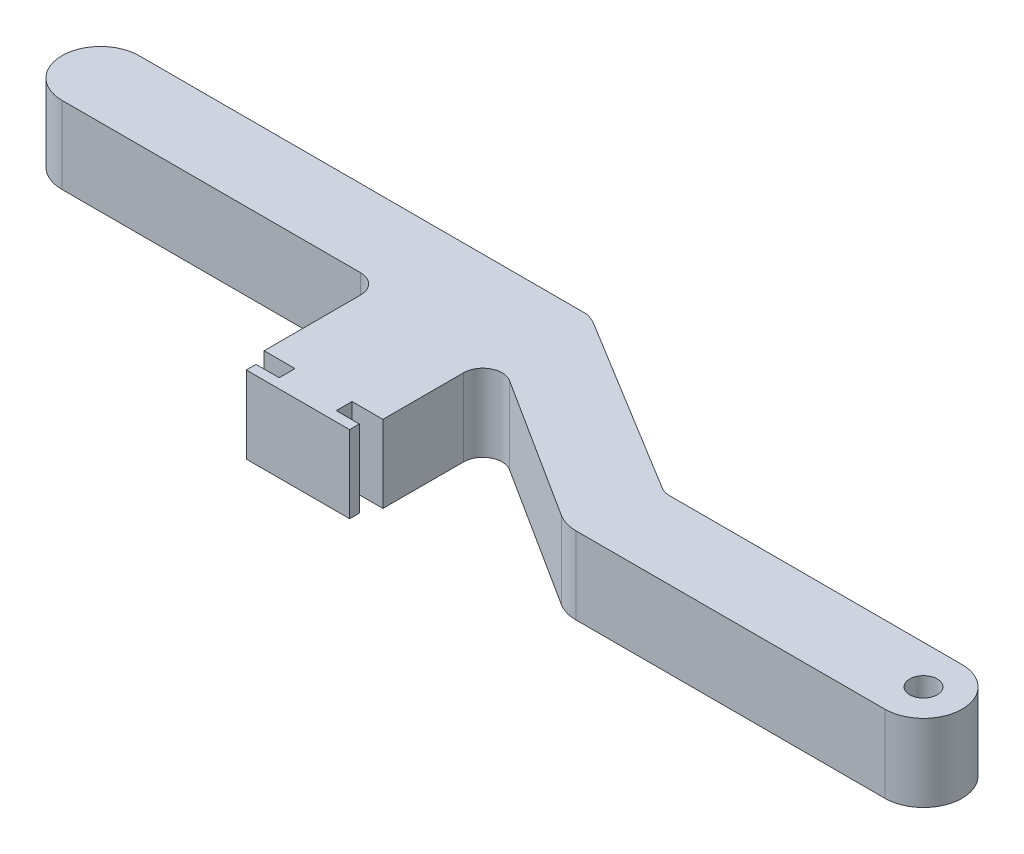
from build123d import *

# Parameters (mm, degrees)
SKETCH1_R           = 1.1303
BOSS_EXTRUDE1_DEPTH = 6.35


with BuildPart() as part:
    # Sketch1 → Boss-Extrude1 (new body)
    with BuildSketch(Plane(origin=(0, 0, 0), x_dir=(1, 0, 0), z_dir=(0, 1, 0))):
        with BuildLine():
            Line((1.430315472, -2.155489974), (-22.62836127, -2.155489974))
            ThreePointArc((-22.62836127, -2.155489974), (-23.058725894, -2.096041852), (-23.456858243, -1.922149868))
            Line((-23.456858243, -1.922149868), (-37.881091448, 6.902829812))
            ThreePointArc((-37.881091448, 6.902829812), (-38.398503134, 7.18649116), (-38.959469005, 7.369510026))
            Line((-38.959469005, 7.369510026), (-75.77856814, 7.369510026))
            ThreePointArc((-75.77856814, 7.369510026), (-78.95356814, 4.194510026), (-75.77856814, 1.019510026))
            Line((-75.77856814, 1.019510026), (-51.211184528, 1.019510026))
            ThreePointArc((-51.211184528, 1.019510026), (-50.088652513, 0.554542041), (-49.623684528, -0.567989974))
            Line((-49.623684528, -0.567989974), (-49.623684528, -8.505489974))
            Line((-49.623684528, -8.505489974), (-47.083684528, -8.505489974))
            Line((-47.083684528, -8.505489974), (-47.083684528, -9.805489974))
            Line((-47.083684528, -9.805489974), (-48.988684528, -9.805489974))
            Line((-48.988684528, -9.805489974), (-48.988684528, -10.605489974))
            Line((-48.988684528, -10.605489974), (-40.48868451, -10.605489974))
            Line((-40.48868451, -10.605489974), (-40.48868451, -9.805489974))
            Line((-40.48868451, -9.805489974), (-42.39368451, -9.805489974))
            Line((-42.39368451, -9.805489974), (-42.39368451, -8.505489974))
            Line((-42.39368451, -8.505489974), (-39.85368451, -8.505489974))
            Line((-39.85368451, -8.505489974), (-39.85368451, -1.873214268))
            ThreePointArc((-39.85368451, -1.873214268), (-39.029938005, -0.481511409), (-37.413575094, -0.534105074))
            Line((-37.413575094, -0.534105074), (-25.626678473, -8.038809761))
            ThreePointArc((-25.626678473, -8.038809761), (-24.830413776, -8.386593729), (-23.969684528, -8.505489974))
            Line((-23.969684528, -8.505489974), (1.430315472, -8.505489974))
            ThreePointArc((1.430315472, -8.505489974), (4.605315472, -5.330489974), (1.430315472, -2.155489974))
        make_face()
        with Locations(Location((1.430315472, -5.330489974, 0), (0, 0, 270))):
            Circle(SKETCH1_R, mode=Mode.SUBTRACT)
    extrude(amount=BOSS_EXTRUDE1_DEPTH)


solid = part.part
